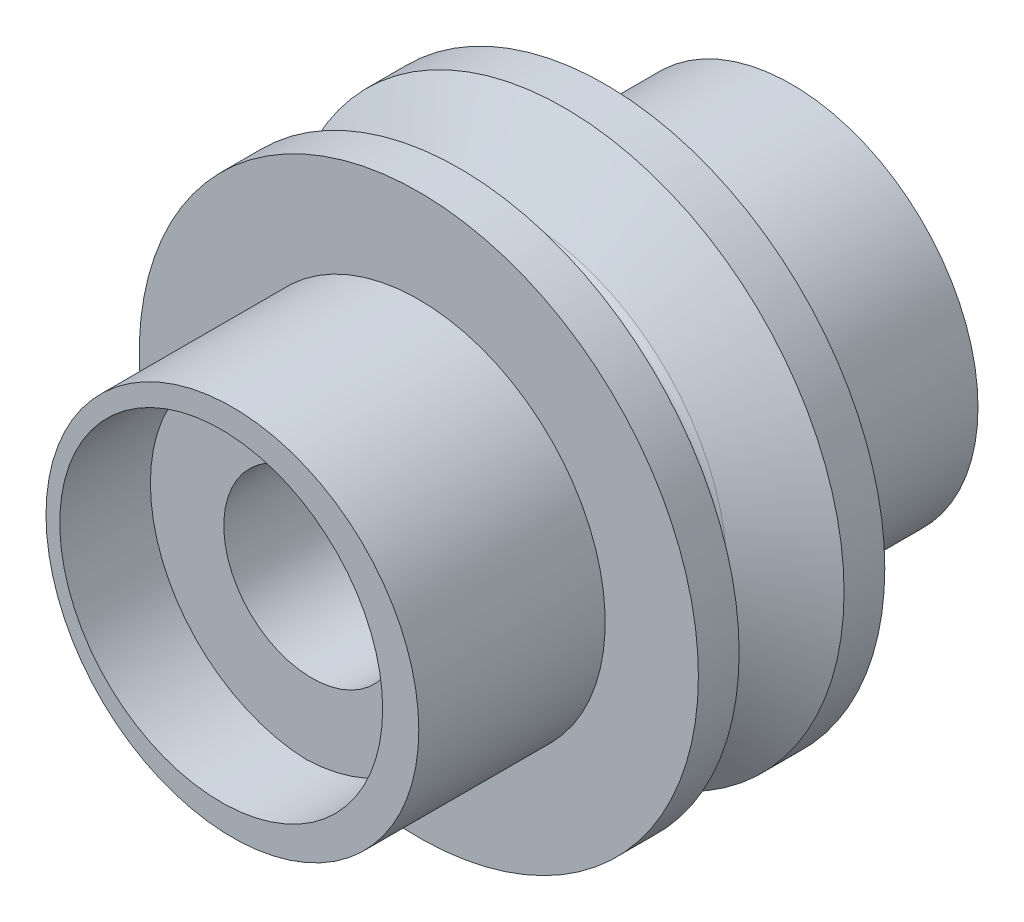
from build123d import *
from build123d.topology import SkipClean

# Parameters (mm, degrees)
SKETCH1_R           = 12.7
SKETCH1_R_2         = 11
BOSS_EXTRUDE1_DEPTH = 12.7


with BuildPart() as part:
    # Sketch1 → Boss-Extrude1 (new body)
    with BuildSketch(Plane.XY):
        Circle(SKETCH1_R)
        with Locations((-0.762, 0)):
            Circle(SKETCH1_R_2, mode=Mode.SUBTRACT)
    extrude(amount=BOSS_EXTRUDE1_DEPTH)

    # Sketch2 → Revolve1 (revolve)
    with BuildSketch(Plane(origin=(0, 0, 0), x_dir=(0, 0, -1), z_dir=(1, 0, 0))):
        with BuildLine():
            Line((-7.2874886, 11), (-7.2874886, 6))
            Line((-7.2874886, 6), (6.35, 6))
            Line((6.35, 6), (6.35, 13.62))
            ThreePointArc((6.35, 13.62), (5.969, 13.722088642), (5.690088642, 14.001))
            Line((5.690088642, 14.001), (2.775047133, 19.05))
            Line((2.775047133, 19.05), (0, 19.05))
            Line((0, 19.05), (0, 11))
            Line((0, 11), (-7.2874886, 11))
        make_face()
    revolve(axis=Axis((0, 0, 0), (0, 0, -1)))

    # Mirror1: part across plane


with BuildPart() as part_1:
    with SkipClean():  # the faces are left unmerged after this step: merging them gives an invalid solid
        add(part.part)
        add(part.part.mirror(Plane(origin=(0, 6, -6.35), x_dir=(1, 0, 0), z_dir=(0, 0, 1))))


solid = part_1.part
